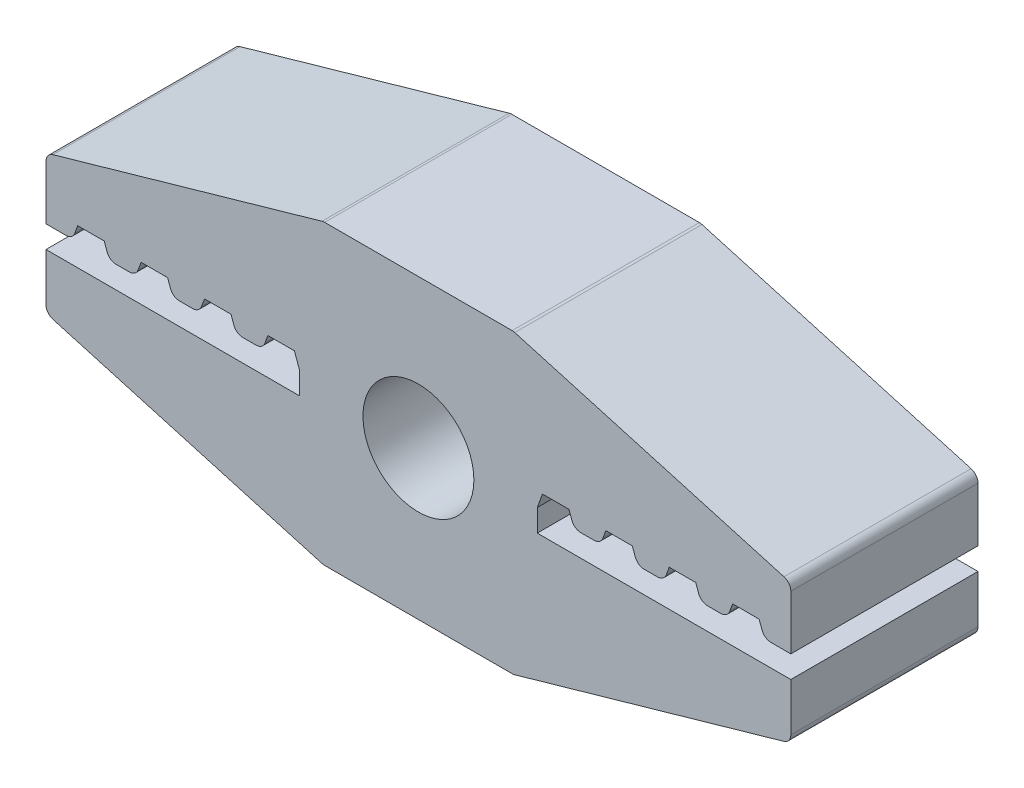
from build123d import *

# Parameters (mm, degrees)
SKETCH1_W           = 23.876
SKETCH1_H           = 9.525
SKETCH1_R           = 1.778
BOSS_EXTRUDE1_DEPTH = 6
CUT_EXTRUDE3_DEPTH  = 15.184401653
FILLET1_R           = 0.3048


with BuildPart() as part:
    # Sketch1 → Boss-Extrude1 (new body)
    with BuildSketch(Plane.XY):
        Rectangle(SKETCH1_W, SKETCH1_H)
        Circle(SKETCH1_R, mode=Mode.SUBTRACT)
    extrude(amount=BOSS_EXTRUDE1_DEPTH)

    # Sketch2 → Cut-Extrude3 (cut, through all)
    with BuildSketch(Plane.XY.offset(6)):
        Polygon((-11.938, -0.4572), (-3.81, -0.4572), (-3.81, 0), (-3.81, 0.254), (-3.976407191, 0.7112), (-4.826, 0.7112), (-4.992407191, 0.254), (-5.842, 0.254), (-6.008407191, 0.7112), (-6.858, 0.7112), (-7.024407191, 0.254), (-7.874, 0.254), (-8.040407191, 0.7112), (-8.89, 0.7112), (-9.056407191, 0.254), (-9.906, 0.254), (-10.072407191, 0.7112), (-10.922, 0.7112), (-11.088407191, 0.254), (-11.938, 0.254), align=None)
        Polygon((-11.938, 4.7625), (-11.938, 2.2225), (-3.048, 4.7625), align=None)
        Polygon((-11.938, -2.2225), (-11.938, -4.7625), (-3.048, -4.7625), align=None)
    cut_extrude3 = extrude(amount=-CUT_EXTRUDE3_DEPTH, mode=Mode.SUBTRACT)

    # Mirror1: Cut-Extrude3 across plane
    add(cut_extrude3.mirror(Plane(origin=(0, 0, 0), x_dir=(0, 0, 1), z_dir=(1, 0, 0))), mode=Mode.SUBTRACT)

    # Fillet1
    fillet1_edges = [part.edges().sort_by_distance(p)[0] for p in [
        (4.992407191, 0.254, 3),
        (5.842, 0.254, 3),
        (7.024407191, 0.254, 3),
        (7.874, 0.254, 3),
        (9.056407191, 0.254, 3),
        (9.906, 0.254, 3),
        (11.088407191, 0.254, 3),
        (3.048, 4.7625, 3),
        (11.938, 2.2225, 3),
        (3.048, -4.7625, 3),
        (11.938, -2.2225, 3),
        (-11.088407191, 0.254, 3),
        (-9.906, 0.254, 3),
        (-9.056407191, 0.254, 3),
        (-7.874, 0.254, 3),
        (-7.024407191, 0.254, 3),
        (-5.842, 0.254, 3),
        (-4.992407191, 0.254, 3),
        (-3.048, 4.7625, 3),
        (-11.938, 2.2225, 3),
        (-11.938, -2.2225, 3),
        (-3.048, -4.7625, 3),
    ]]
    fillet(fillet1_edges, radius=FILLET1_R)


solid = part.part
